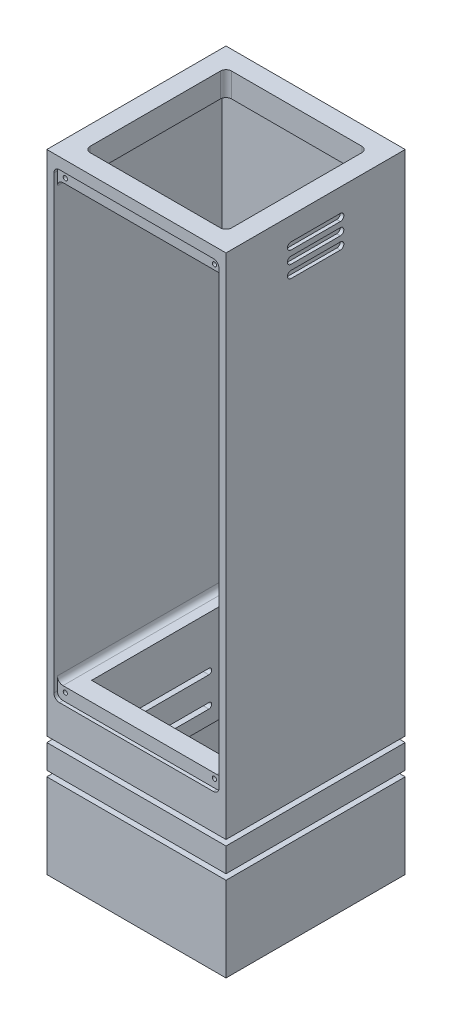
from build123d import *

# Parameters (mm, degrees)
SKETCH1_W                 = 50.8
SKETCH1_H                 = 50.8
SKETCH1_W_2               = 38.1
SKETCH1_H_2               = 38.1
BOSS_EXTRUDE1_DEPTH       = 178
SKETCH2_W                 = 44.8
SKETCH2_H                 = 44.8
SKETCH2_W_2               = 38.1
SKETCH2_H_2               = 38.1
CUT_EXTRUDE1_DEPTH        = 20
SKETCH3_W                 = 46.8
SKETCH3_H                 = 123.47500012
CUT_EXTRUDE2_DEPTH        = 47.625
CUT_EXTRUDE5_DEPTH        = 1
SKETCH7_W                 = 46.8
SKETCH7_H                 = 3.675
CUT_EXTRUDE6_DEPTH        = 1
FILLET1_R                 = 1.5875
CUT_EXTRUDE7_REACH        = 193.951
F_0_80_TAPPED_HOLE1_D     = 1.19126
F_0_80_TAPPED_HOLE1_DEPTH = 2.9997
F_0_80_TAPPED_HOLE1_TIP   = 0.357890611
SKETCH19_W                = 50.8
SKETCH19_H                = 1.5875
CUT_EXTRUDE12_DEPTH       = 4
CIRPATTERN1_COUNT         = 4
CUT_EXTRUDE13_DEPTH       = 191.931610793
LPATTERN1_COUNT           = 2
LPATTERN1_PITCH           = 8.41
LPATTERN1_COPY_1_SKETCH_W = 50.8
LPATTERN1_COPY_1_SKETCH_H = 1.5875
LPATTERN1_COPY_1_DEPTH    = 4
LPATTERN1_COPY_2_SKETCH_W = 50.8
LPATTERN1_COPY_2_SKETCH_H = 1.5875
LPATTERN1_COPY_2_DEPTH    = 4
LPATTERN1_COPY_3_SKETCH_W = 50.8
LPATTERN1_COPY_3_SKETCH_H = 1.5875
LPATTERN1_COPY_3_DEPTH    = 4


with BuildPart() as part:
    # Sketch1 → Boss-Extrude1 (new body)
    with BuildSketch(Plane(origin=(0, 0, 0), x_dir=(1, 0, 0), z_dir=(0, 1, 0))):
        with Locations((25.4, 25.4)):
            Rectangle(SKETCH1_W, SKETCH1_H)
        with Locations((25.4, 25.4)):
            Rectangle(SKETCH1_W_2, SKETCH1_H_2, mode=Mode.SUBTRACT)
    extrude(amount=BOSS_EXTRUDE1_DEPTH)

    # Sketch2 → Cut-Extrude1 (cut)
    with BuildSketch(Plane.XZ):
        with Locations((25.4, -25.4)):
            Rectangle(SKETCH2_W, SKETCH2_H)
        with Locations((25.4, -25.4)):
            Rectangle(SKETCH2_W_2, SKETCH2_H_2, mode=Mode.SUBTRACT)
    extrude(amount=-CUT_EXTRUDE1_DEPTH, mode=Mode.SUBTRACT)

    # Sketch3 → Cut-Extrude2 (cut)
    with BuildSketch(Plane.XY):
        with Locations((25.4, 109.41249994)):
            Rectangle(SKETCH3_W, SKETCH3_H)
    extrude(amount=-CUT_EXTRUDE2_DEPTH, mode=Mode.SUBTRACT)

    # Sketch6 → Cut-Extrude5 (cut)
    with BuildSketch(Plane.ZY):
        with BuildLine():
            Line((-32.4, 171.5), (-18.4, 171.5))
            ThreePointArc((-18.4, 171.5), (-17.4, 170.5), (-18.4, 169.5))
            Line((-18.4, 169.5), (-32.4, 169.5))
            ThreePointArc((-32.4, 169.5), (-33.4, 170.5), (-32.4, 171.5))
        make_face()
        with BuildLine():
            Line((-32.4, 168), (-18.4, 168))
            ThreePointArc((-18.4, 168), (-17.4, 167), (-18.4, 166))
            Line((-18.4, 166), (-32.4, 166))
            ThreePointArc((-32.4, 166), (-33.4, 167), (-32.4, 168))
        make_face()
        with BuildLine():
            Line((-32.4, 164.5), (-18.4, 164.5))
            ThreePointArc((-18.4, 164.5), (-17.4, 163.5), (-18.4, 162.5))
            Line((-18.4, 162.5), (-32.4, 162.5))
            ThreePointArc((-32.4, 162.5), (-33.4, 163.5), (-32.4, 164.5))
        make_face()
    cut_extrude5 = extrude(amount=-CUT_EXTRUDE5_DEPTH, mode=Mode.SUBTRACT)

    # Mirror2: Cut-Extrude5 across plane
    add(cut_extrude5.mirror(Plane.ZY.offset(-25.4)), mode=Mode.SUBTRACT)

    # Sketch7 → Cut-Extrude6 (cut)
    with BuildSketch(Plane.XY):
        with Locations((25.4, 172.9875)):
            Rectangle(SKETCH7_W, SKETCH7_H)
        with Locations((25.4, 45.83749988)):
            Rectangle(SKETCH7_W, SKETCH7_H)
    extrude(amount=-CUT_EXTRUDE6_DEPTH, mode=Mode.SUBTRACT)

    # Fillet1
    fillet1_edges = [part.edges().sort_by_distance(p)[0] for p in [
        (47.8, 10, -47.8),
        (47.8, 10, -3),
        (3, 10, -47.8),
        (3, 10, -3),
        (48.8, 47.67499988, -24.3125),
        (2, 47.67499988, -24.3125),
        (48.8, 171.15, -24.3125),
        (2, 171.15, -24.3125),
        (48.8, 174.825, -0.5),
        (2, 174.825, -0.5),
        (48.8, 43.99999988, -0.5),
        (2, 43.99999988, -0.5),
    ]]
    fillet(fillet1_edges, radius=FILLET1_R)

    # Sketch8 → Cut-Extrude7 (cut, up to next)
    with BuildSketch(Plane(origin=(0, 178, 0), x_dir=(1, 0, 0), z_dir=(0, 1, 0)), mode=Mode.PRIVATE) as cut_extrude7_sk1:
        with BuildLine():
            Line((6.9375, 45.45), (43.8625, 45.45))
            ThreePointArc((43.8625, 45.45), (44.985032015, 44.985032015), (45.45, 43.8625))
            Line((45.45, 43.8625), (45.45, 6.9375))
            ThreePointArc((45.45, 6.9375), (44.985032015, 5.814967985), (43.8625, 5.35))
            Line((43.8625, 5.35), (6.9375, 5.35))
            ThreePointArc((6.9375, 5.35), (5.814967985, 5.814967985), (5.35, 6.9375))
            Line((5.35, 6.9375), (5.35, 43.8625))
            ThreePointArc((5.35, 43.8625), (5.814967985, 44.985032015), (6.9375, 45.45))
        make_face()
    cut_extrude7_tool1 = extrude(cut_extrude7_sk1.sketch, amount=-CUT_EXTRUDE7_REACH, mode=Mode.PRIVATE) & part.part
    add(cut_extrude7_tool1.solids().sort_by_distance((25.4, 178, -25.4))[0], mode=Mode.SUBTRACT)

    # #0-80 Tapped Hole1
    with Locations(Plane.XY.offset(-1)):
        with Locations((4.25425, 172.571000052), (46.51375, 172.571000052), (4.25425, 46.285999828), (46.51375, 46.285999828)):
            Hole(F_0_80_TAPPED_HOLE1_D / 2, depth=F_0_80_TAPPED_HOLE1_DEPTH)
            with Locations((0, 0, -(F_0_80_TAPPED_HOLE1_DEPTH + F_0_80_TAPPED_HOLE1_TIP / 2))):  # 118° drill point
                Cone(0, F_0_80_TAPPED_HOLE1_D / 2, F_0_80_TAPPED_HOLE1_TIP, mode=Mode.SUBTRACT)

    # Sketch19 → Cut-Extrude12 (cut)
    with BuildSketch(Plane.XY):
        with Locations((25.4, 24.79375)):
            Rectangle(SKETCH19_W, SKETCH19_H)
    cut_extrude12 = extrude(amount=-CUT_EXTRUDE12_DEPTH, mode=Mode.SUBTRACT)

    # CirPattern1: Cut-Extrude12 ×4 about axis
    cirpattern1_axis = Axis((25.4, 29.542937729, -25.4), (0, -1, 0))
    for i in range(1, CIRPATTERN1_COUNT):
        add(cut_extrude12.rotate(cirpattern1_axis, i * 360 / CIRPATTERN1_COUNT), mode=Mode.SUBTRACT)

    # Sketch20 → Cut-Extrude13 (cut, through all)
    with BuildSketch(Plane(origin=(46.8, 0, -50.8), x_dir=(0, 0, 1), z_dir=(-1, 0, 0))):
        with BuildLine():
            Line((11.19375, 25.5875), (39.60625, 25.5875))
            ThreePointArc((39.60625, 25.5875), (40.4, 24.79375), (39.60625, 24))
            Line((39.60625, 24), (11.19375, 24))
            ThreePointArc((11.19375, 24), (10.4, 24.79375), (11.19375, 25.5875))
        make_face()
    cut_extrude13 = extrude(amount=CUT_EXTRUDE13_DEPTH, mode=Mode.SUBTRACT)

    # LPattern1: Cut-Extrude12, Cut-Extrude13 ×2
    with Locations(*[(0, i * LPATTERN1_PITCH, 0) for i in range(1, LPATTERN1_COUNT)]):
        add(cut_extrude12, mode=Mode.SUBTRACT)
        add(cut_extrude13, mode=Mode.SUBTRACT)

    # LPattern1 copy 1 sketch → LPattern1 copy 1 (cut)
    with BuildSketch(Plane(origin=(0, 8.41, -50.8), x_dir=(0, 0, 1), z_dir=(-1, 0, 0))):
        with Locations((25.4, 24.79375)):
            Rectangle(LPATTERN1_COPY_1_SKETCH_W, LPATTERN1_COPY_1_SKETCH_H)
    extrude(amount=-LPATTERN1_COPY_1_DEPTH, mode=Mode.SUBTRACT)

    # LPattern1 copy 2 sketch → LPattern1 copy 2 (cut)
    with BuildSketch(Plane(origin=(50.8, 8.41, -50.8), x_dir=(-1, 0, 0), z_dir=(0, 0, -1))):
        with Locations((25.4, 24.79375)):
            Rectangle(LPATTERN1_COPY_2_SKETCH_W, LPATTERN1_COPY_2_SKETCH_H)
    extrude(amount=-LPATTERN1_COPY_2_DEPTH, mode=Mode.SUBTRACT)

    # LPattern1 copy 3 sketch → LPattern1 copy 3 (cut)
    with BuildSketch(Plane(origin=(50.8, 8.41, 0), x_dir=(0, 0, -1), z_dir=(1, 0, 0))):
        with Locations((25.4, 24.79375)):
            Rectangle(LPATTERN1_COPY_3_SKETCH_W, LPATTERN1_COPY_3_SKETCH_H)
    extrude(amount=-LPATTERN1_COPY_3_DEPTH, mode=Mode.SUBTRACT)


solid = part.part
